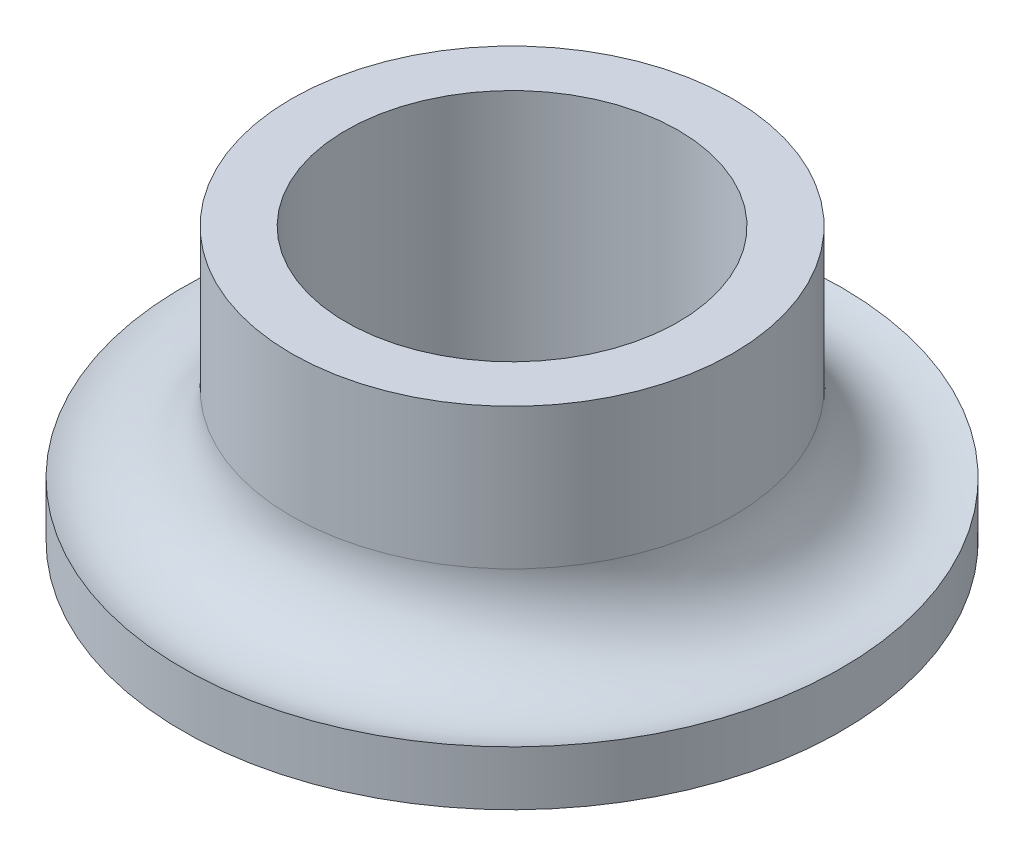
from build123d import *


with BuildPart() as part:
    # Esquisse1 → Révolution1 (revolve)
    with BuildSketch(Plane.XY, mode=Mode.PRIVATE) as r_volution1_sk:
        with BuildLine():
            Line((-4.05, 5), (-4.05, 2.414213562))
            ThreePointArc((-4.05, 2.414213562), (-4.683974596, 1.189468691), (-6.05, 1))
            Line((-6.05, 1), (-6.05, 0))
            Line((-6.05, 0), (-3.05, 0))
            Line((-3.05, 0), (-3.05, 5))
            Line((-3.05, 5), (-4.05, 5))
        make_face()
    revolve(r_volution1_sk.sketch.rotate(Axis((0, 0, 0), (0, 1, 0)), 270), axis=Axis((0, 0, 0), (0, 1, 0)))


solid = part.part
